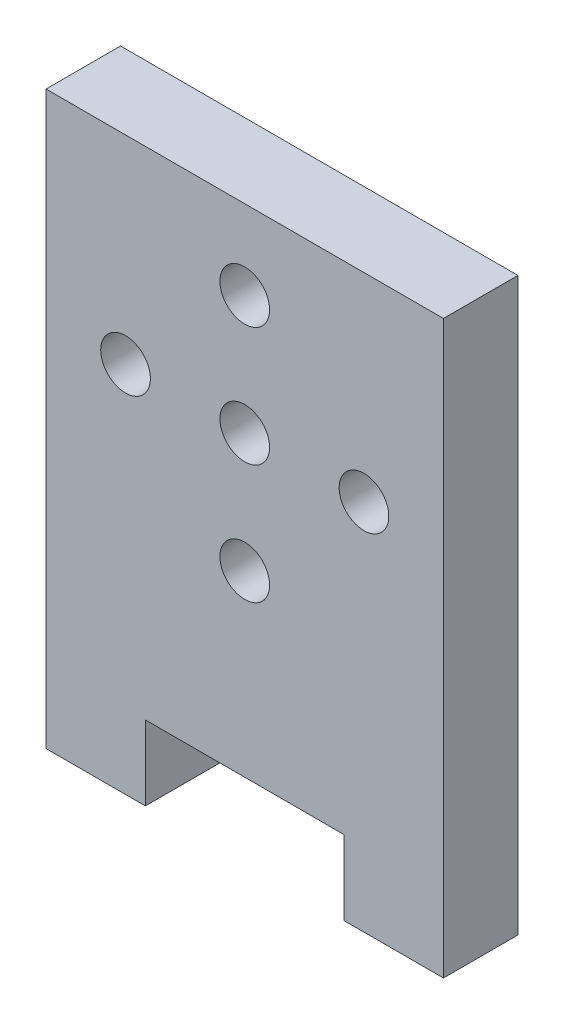
from build123d import *

# Parameters (mm, degrees)
SKETCH1_R           = 1.5875
BOSS_EXTRUDE1_DEPTH = 4.7625


with BuildPart() as part:
    # Sketch1 → Boss-Extrude1 (new body)
    with BuildSketch(Plane.XY):
        Polygon((0, 0), (12.7, 0), (12.7, -4.7625), (19.05, -4.7625), (19.05, 31.75), (-6.35, 31.75), (-6.35, -4.7625), (0, -4.7625), align=None)
        with Locations(Location((6.35, 19.05, 0), (0, 0, 180))):
            Circle(SKETCH1_R, mode=Mode.SUBTRACT)
        with Locations(Location((6.35, 26.67, 0), (0, 0, 180))):
            Circle(SKETCH1_R, mode=Mode.SUBTRACT)
        with Locations(Location((13.97, 19.05, 0), (0, 0, 180))):
            Circle(SKETCH1_R, mode=Mode.SUBTRACT)
        with Locations(Location((-1.27, 19.05, 0), (0, 0, 180))):
            Circle(SKETCH1_R, mode=Mode.SUBTRACT)
        with Locations(Location((6.35, 11.43, 0), (0, 0, 180))):
            Circle(SKETCH1_R, mode=Mode.SUBTRACT)
    extrude(amount=BOSS_EXTRUDE1_DEPTH)


solid = part.part
